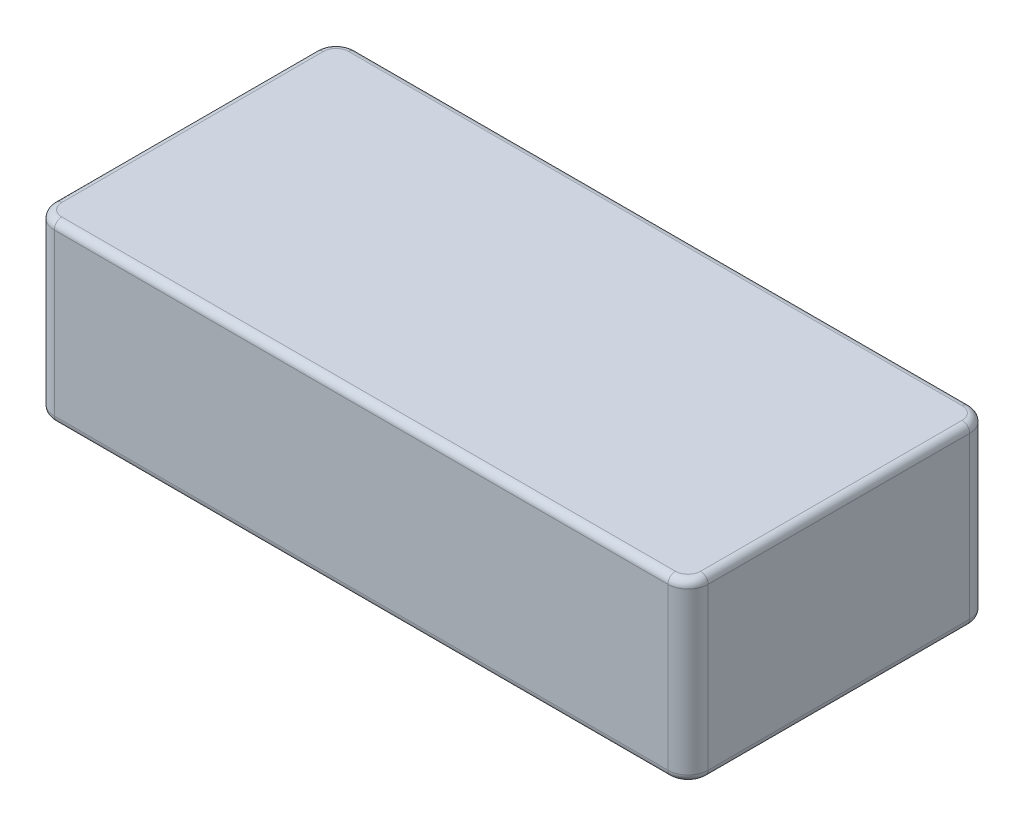
from build123d import *

# Parameters (mm, degrees)
SKETCH_1_W      = 260
SKETCH_1_H      = 120
EXTRUDE_1_DEPTH = 35
FILLET_1_R      = 8
FILLET_2_R      = 3
SKETCH_2_R      = 3.5
EXTRUDE_2_DEPTH = 20


with BuildPart() as part:
    # 草图1 → 凸台-拉伸1 (new, symmetric)
    with BuildSketch(Plane(origin=(0, 0, 0), x_dir=(1, 0, 0), z_dir=(0, 1, 0))):
        Rectangle(SKETCH_1_W, SKETCH_1_H)
    extrude(amount=EXTRUDE_1_DEPTH, both=True)

    # 圆角1
    fillet_1_edges = [part.edges().sort_by_distance(p)[0] for p in [
        (-130, 0, -60),
        (130, 0, -60),
        (130, 0, 60),
        (-130, 0, 60),
    ]]
    fillet(fillet_1_edges, radius=FILLET_1_R)

    # 圆角2
    fillet_2_edges = [part.edges().sort_by_distance(p)[0] for p in [
        (0, -35, -60),
        (0, 35, -60),
        (-130, -35, 0),
        (130, -35, 0),
        (0, -35, 60),
        (-127.656854249, -35, -57.656854249),
        (-127.656854249, -35, 57.656854249),
        (127.656854249, -35, 57.656854249),
        (127.656854249, -35, -57.656854249),
        (130, 35, 0),
        (-130, 35, 0),
        (0, 35, 60),
        (-127.656854249, 35, -57.656854249),
        (-127.656854249, 35, 57.656854249),
        (127.656854249, 35, 57.656854249),
        (127.656854249, 35, -57.656854249),
    ]]
    fillet(fillet_2_edges, radius=FILLET_2_R)

    # 草图2 → 凸台-拉伸2 (add, symmetric)
    with BuildSketch(Plane.ZY.offset(130)):
        with Locations(Location((-56.5, 4, 0), (0, 0, 180))):
            Circle(SKETCH_2_R)
        with Locations(Location((-56.5, -4, 0), (0, 0, 180))):
            Circle(SKETCH_2_R)
    extrude(amount=EXTRUDE_2_DEPTH, both=True)


solid = part.part
